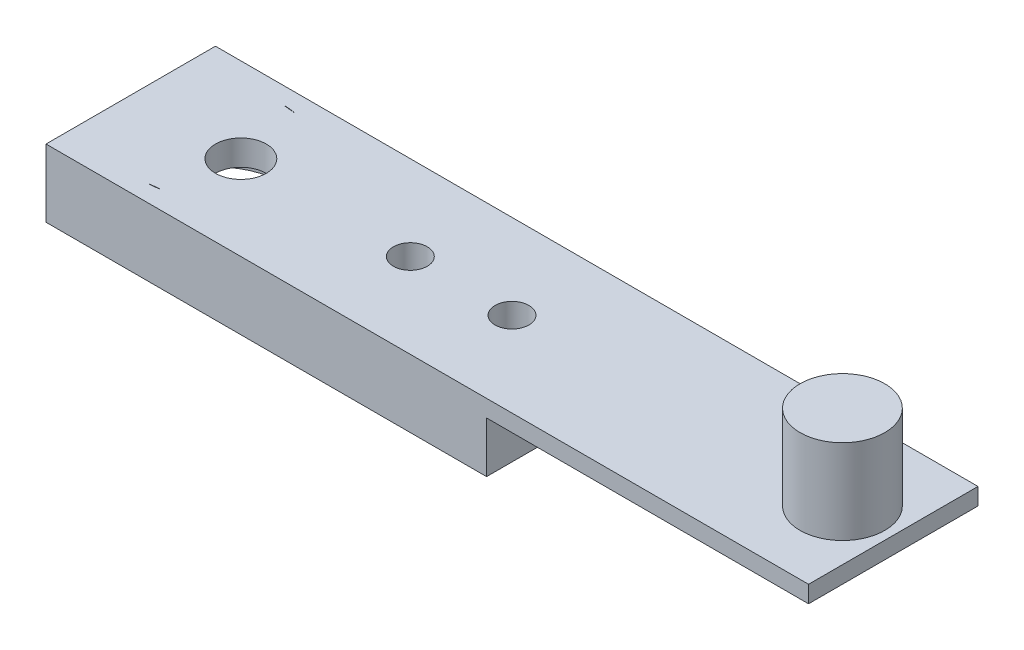
from build123d import *
from build123d.topology import SkipClean

# Parameters (mm, degrees)
SKETCH1_W                = 26
SKETCH1_H                = 10
SKETCH1_R                = 1.5
SKETCH1_R_2              = 1
MAINBODY_DEPTH           = 4
PUSHEXTRUSION_DEPTH      = 5
PUSHEXTRUSION_DEPTH_BACK = 1
PUSHEXTRUSION_START      = 4
SKETCH1_5_R              = 2.5
SKETCH1_6_W              = 20
SKETCH1_6_H              = 4
SKETCH1_6_R              = 1.5
SKETCH1_6_R_2            = 1
CUT_EXTRUDE1_DEPTH       = 2.5
BOSS_EXTRUDE1_START      = 4
SKETCH1_7_W              = 19
SKETCH1_7_H              = 10
SKETCH1_7_R              = 2.5
BOSS_EXTRUDE1_DEPTH      = 1


with BuildPart() as part:
    # Sketch1 → MainBody (new body)
    with BuildSketch(Plane(origin=(0, 0, 0), x_dir=(1, 0, 0), z_dir=(0, 1, 0))):
        with Locations((13, 5)):
            Rectangle(SKETCH1_W, SKETCH1_H)
        with Locations(Location((6.5, 5, 0), (0, 0, 270))):
            Circle(SKETCH1_R, mode=Mode.SUBTRACT)
        with BuildLine():
            ThreePointArc((5, 9), (5.398014876, 8.980148761), (5.792079208, 8.920792079))
            Line((5.792079208, 8.920792079), (5, 9))
        make_face(mode=Mode.SUBTRACT)
        with BuildLine():
            ThreePointArc((5.792079208, 1.079207921), (5.398014876, 1.019851239), (5, 1))
            Line((5, 1), (5.792079208, 1.079207921))
        make_face(mode=Mode.SUBTRACT)
        with Locations(Location((16.5, 5, 0), (0, 0, 270))):
            Circle(SKETCH1_R_2, mode=Mode.SUBTRACT)
        with Locations(Location((22.5, 5, 0), (0, 0, 270))):
            Circle(SKETCH1_R_2, mode=Mode.SUBTRACT)
    extrude(amount=MAINBODY_DEPTH)

    # Sketch1<6> → Cut-Extrude1 (cut)
    # profile 1 of 4: a face of its own
    with SkipClean():  # the faces are left unmerged after this step: merging them gives an invalid solid
        with BuildSketch(Plane(origin=(0, 0, 0), x_dir=(1, 0, 0), z_dir=(0, 1, 0))):
            with Locations((15, 5)):
                Rectangle(SKETCH1_6_W, SKETCH1_6_H)
            with Locations(Location((6.5, 5, 0), (0, 0, 270))):
                Circle(SKETCH1_6_R, mode=Mode.SUBTRACT)
            with Locations(Location((16.5, 5, 0), (0, 0, 270))):
                Circle(SKETCH1_6_R_2, mode=Mode.SUBTRACT)
            with Locations(Location((22.5, 5, 0), (0, 0, 270))):
                Circle(SKETCH1_6_R_2, mode=Mode.SUBTRACT)
        # profile 2 of 4: a face of its own
        with BuildSketch(Plane(origin=(0, 0, 0), x_dir=(1, 0, 0), z_dir=(0, 1, 0))):
            Polygon((25, 7), (5, 9), (5, 7), align=None)
        # profile 3 of 4: a face of its own
        with BuildSketch(Plane(origin=(0, 0, 0), x_dir=(1, 0, 0), z_dir=(0, 1, 0))):
            Polygon((25, 3), (5, 1), (5, 3), align=None)
        # profile 4 of 4: a face of its own
        with BuildSketch(Plane(origin=(0, 0, 0), x_dir=(1, 0, 0), z_dir=(0, 1, 0))):
            with BuildLine():
                Line((5, 5), (5, 7))
                Line((5, 7), (5, 9))
                ThreePointArc((5, 9), (1, 5), (5, 1))
                Line((5, 1), (5, 3))
                Line((5, 3), (5, 5))
            make_face()
        extrude(amount=CUT_EXTRUDE1_DEPTH, mode=Mode.SUBTRACT)



with BuildPart() as body_2:
    # Sketch1<5> → PushExtrusion (new, two sides: drawn at the far end of the back side and taken through both)
    with BuildSketch(Plane(origin=(0, 0, 0), x_dir=(1, 0, 0), z_dir=(0, 1, 0)).offset(PUSHEXTRUSION_START - PUSHEXTRUSION_DEPTH_BACK)):
        with Locations(Location((42, 5, 0), (0, 0, 270))):
            Circle(SKETCH1_5_R)
    extrude(amount=PUSHEXTRUSION_DEPTH + PUSHEXTRUSION_DEPTH_BACK)


with BuildPart() as part_1:
    with SkipClean():  # the faces are left unmerged after this step: merging them gives an invalid solid
        add(part.part)

        add(body_2.part)  # Boss-Extrude1 merges body 2
        # Sketch1<7> → Boss-Extrude1 (add)
        with BuildSketch(Plane(origin=(0, 0, 0), x_dir=(1, 0, 0), z_dir=(0, 1, 0)).offset(BOSS_EXTRUDE1_START)):
            with Locations((35.5, 5)):
                Rectangle(SKETCH1_7_W, SKETCH1_7_H)
            with Locations(Location((42, 5, 0), (0, 0, 270))):
                Circle(SKETCH1_7_R, mode=Mode.SUBTRACT)
        extrude(amount=-BOSS_EXTRUDE1_DEPTH)


solid = part_1.part
